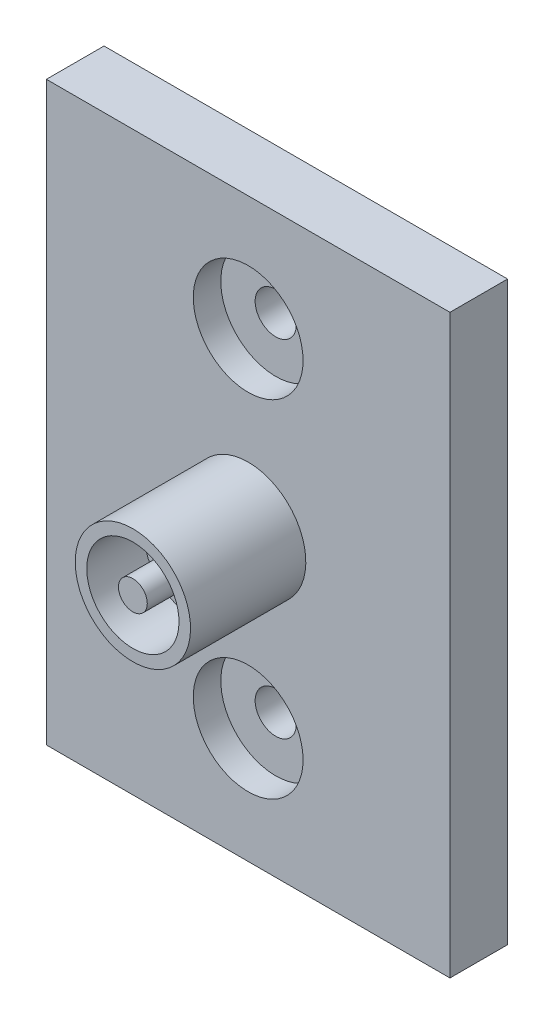
from build123d import *

# Parameters (mm, degrees)
SKETCH1_W                                = 70
SKETCH1_H                                = 100
BOSS_EXTRUDE1_DEPTH                      = 5
SKETCH3_R                                = 2.5
BOSS_EXTRUDE2_DEPTH                      = 20
CBORE_FOR_1_4_HEX_HEAD_BOLT1_D           = 7.14248
CBORE_FOR_1_4_HEX_HEAD_BOLT1_CBORE_D     = 19.05
CBORE_FOR_1_4_HEX_HEAD_BOLT1_CBORE_DEPTH = 4.7752
CIRPATTERN2_COUNT                        = 2
SKETCH8_R                                = 1.5
CUT_EXTRUDE2_DEPTH                       = 10


with BuildPart() as part:
    # Sketch1 → Boss-Extrude1 (new, symmetric)
    with BuildSketch(Plane.XY):
        Rectangle(SKETCH1_W, SKETCH1_H)
    extrude(amount=BOSS_EXTRUDE1_DEPTH, both=True)

    # Sketch3 → Boss-Extrude2 (add)
    with BuildSketch(Plane.XY.offset(5)):
        with Locations(Location((0, 0, 0), (0, 0, 180))):
            Circle(SKETCH3_R)
    extrude(amount=BOSS_EXTRUDE2_DEPTH)

    # Sketch5 → Revolve1 (revolve)
    with BuildSketch(Plane(origin=(0, 0, 0), x_dir=(0, 0, -1), z_dir=(1, 0, 0))):
        Polygon((-5, 6), (-15, 6), (-15, 8), (-25, 8), (-25, 10), (-5, 10), align=None)
    revolve(axis=Axis((0, 0, 0), (0, 0, 1)))

    # CBORE for 1/4 Hex Head Bolt1 (through all)
    with Locations(Plane(origin=(0, 30, 5), x_dir=(1, 0, 0), z_dir=(0, 0, 1))):
        with Locations((0, 0)):
            cbore_for_1_4_hex_head_bolt1 = CounterBoreHole(CBORE_FOR_1_4_HEX_HEAD_BOLT1_D / 2, CBORE_FOR_1_4_HEX_HEAD_BOLT1_CBORE_D / 2, CBORE_FOR_1_4_HEX_HEAD_BOLT1_CBORE_DEPTH)

    # CirPattern2: CBORE for 1/4 Hex Head Bolt1 ×2 about axis
    cirpattern2_axis = Axis((0, 0, 0), (0, 0, 1))
    for i in range(1, CIRPATTERN2_COUNT):
        add(cbore_for_1_4_hex_head_bolt1.rotate(cirpattern2_axis, i * 360 / CIRPATTERN2_COUNT), mode=Mode.SUBTRACT)

    # Sketch8 → Cut-Extrude2 (cut)
    with BuildSketch(Plane(origin=(-5, 0, 0), x_dir=(0, 0, -1), z_dir=(1, 0, 0))):
        with Locations((-14.239336727, 0)):
            Circle(SKETCH8_R)
    extrude(amount=-CUT_EXTRUDE2_DEPTH, mode=Mode.SUBTRACT)


solid = part.part
